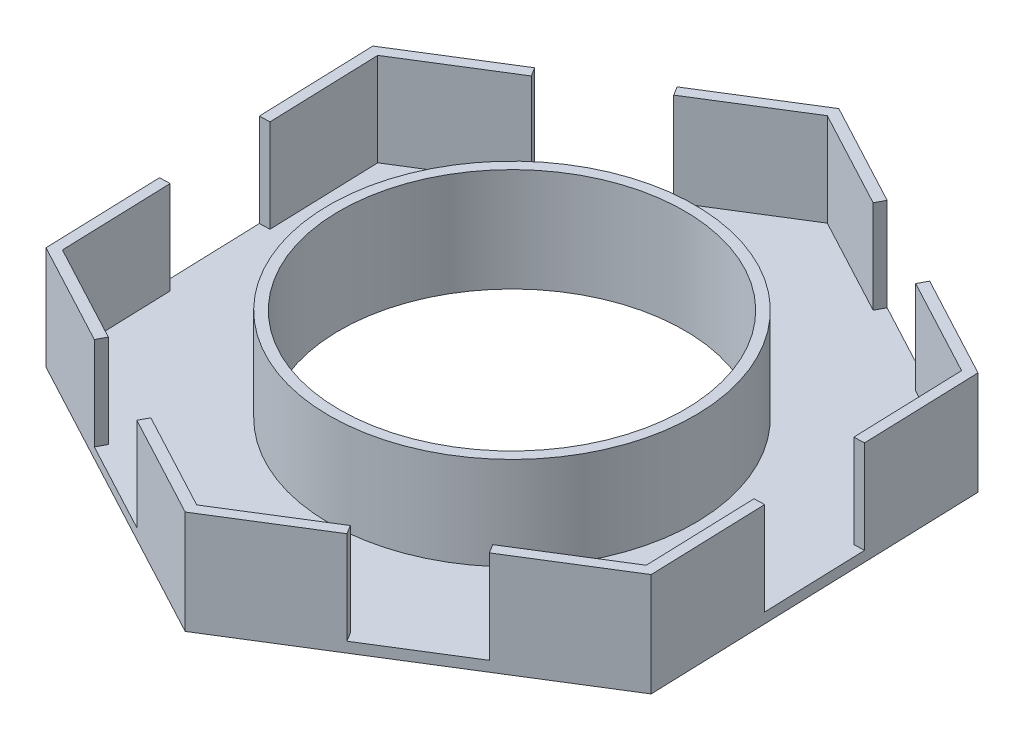
from build123d import *

# Parameters (mm, degrees)
SKETCH2_R           = 50
BOSS_EXTRUDE1_DEPTH = 30
SHELL1_T            = -3
CUT_EXTRUDE1_DEPTH  = 27


with BuildPart() as part:
    # Sketch2 → Boss-Extrude1 (new body)
    with BuildSketch(Plane(origin=(0, 0, 0), x_dir=(1, 0, 0), z_dir=(0, 1, 0))):
        Polygon((-83.314894361, -51.8841181), (3.275517147, -98.09487408), (86.590411508, -46.21075598), (83.314894361, 51.8841181), (-3.275517147, 98.09487408), (-86.590411508, 46.21075598), align=None)
        with Locations(Location((0, 0, 0), (0, 0, 270))):
            Circle(SKETCH2_R, mode=Mode.SUBTRACT)
    extrude(amount=BOSS_EXTRUDE1_DEPTH)

    # Shell1
    shell1_openings = [part.faces().sort_by_distance(p)[0] for p in [
        (-38.787596874, 30, 72.680784017),
    ]]
    offset(amount=SHELL1_T, openings=shell1_openings, kind=Kind.INTERSECTION)

    # Sketch8 → Cut-Extrude1 (cut)
    with BuildSketch(Plane(origin=(0, 30, 0), x_dir=(1, 0, 0), z_dir=(0, 1, 0))):
        Polygon((53.253129093, 67.9271981), (51.840669496, 65.280510003), (25.373788523, 79.405105982), (26.786248121, 82.051794079), align=None)
        Polygon((84.452062159, 17.828325695), (85.453243709, -12.154963576), (82.454914782, -12.255081731), (81.453733232, 17.72820754), align=None)
        Polygon((57.665814038, -64.223468384), (32.200114616, -80.082161676), (30.614245287, -77.535591734), (56.079944709, -61.676898442), align=None)
        Polygon((-26.786248121, -82.051794079), (-53.253129093, -67.9271981), (-51.840669496, -65.280510003), (-25.373788523, -79.405105982), align=None)
        Polygon((-84.452062159, -17.828325695), (-85.453243709, 12.154963576), (-82.454914782, 12.255081731), (-81.453733232, -17.72820754), align=None)
        Polygon((-57.665814038, 64.223468384), (-32.200114616, 80.082161676), (-30.614245287, 77.535591734), (-56.079944709, 61.676898442), align=None)
    extrude(amount=-CUT_EXTRUDE1_DEPTH, mode=Mode.SUBTRACT)


solid = part.part
